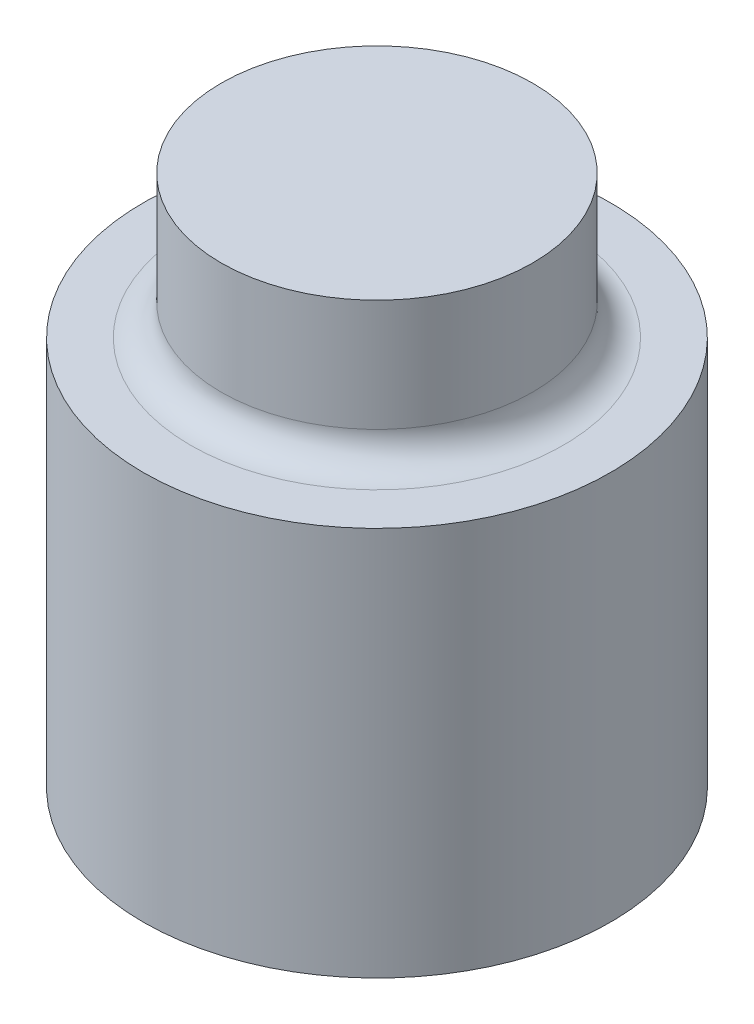
from build123d import *

# Parameters (mm, degrees)
SKETCH1_R           = 76.2
BOSS_EXTRUDE1_DEPTH = 127
SKETCH2_R           = 50.8
BOSS_EXTRUDE2_DEPTH = 46.482
FILLET1_R           = 10.000000066


with BuildPart() as part:
    # Sketch1 → Boss-Extrude1 (new body)
    with BuildSketch(Plane(origin=(0, 0, 0), x_dir=(1, 0, 0), z_dir=(0, 1, 0))):
        with Locations(Location((0, 0, 0), (0, 0, 270))):
            Circle(SKETCH1_R)
    extrude(amount=BOSS_EXTRUDE1_DEPTH)

    # Sketch2 → Boss-Extrude2 (add)
    with BuildSketch(Plane(origin=(0, 127, 0), x_dir=(1, 0, 0), z_dir=(0, 1, 0))):
        with Locations(Location((0, 0, 0), (0, 0, 270))):
            Circle(SKETCH2_R)
    extrude(amount=BOSS_EXTRUDE2_DEPTH)

    # Fillet1
    fillet1_edges = [part.edges().sort_by_distance(p)[0] for p in [
        (0, 127, -50.8),
    ]]
    fillet(fillet1_edges, radius=FILLET1_R)


solid = part.part
